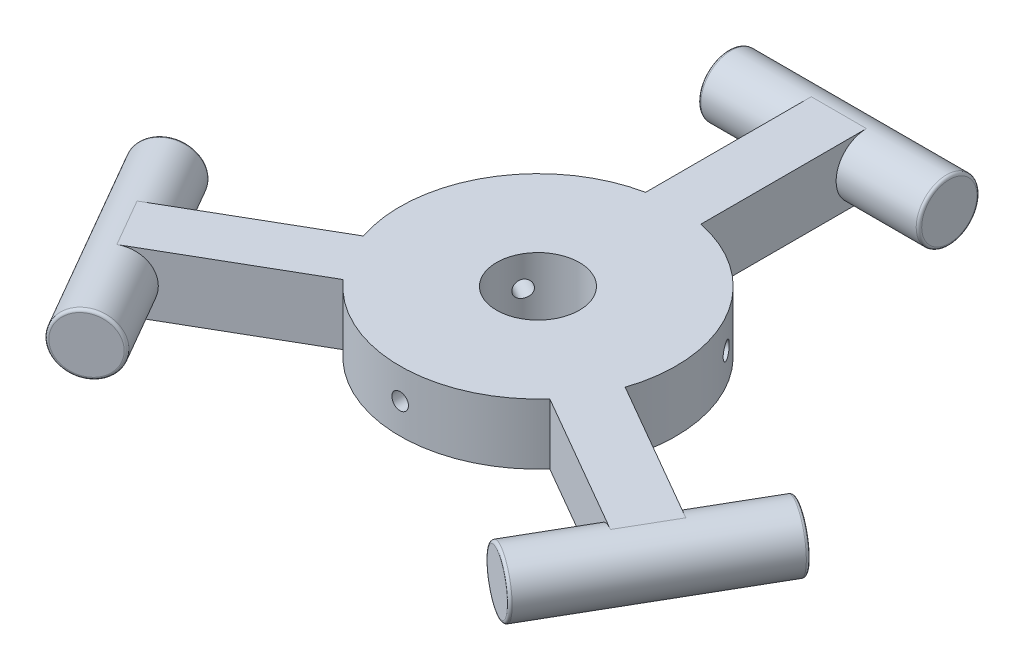
from build123d import *

# Parameters (mm, degrees)
BOSS_EXTRUDE1_DEPTH = 11
CIRPATTERN1_COUNT   = 3
SKETCH4_R           = 1.5
CUT_EXTRUDE1_DEPTH  = 20
CIRPATTERN3_COUNT   = 3


with BuildPart() as part:
    # Sketch1 → Boss-Extrude1 (new body)
    with BuildSketch(Plane(origin=(0, 0, 0), x_dir=(1, 0, 0), z_dir=(0, 1, 0))):
        with BuildLine():
            ThreePointArc((5, 24.494897428), (2.51272405, 24.873403825), (0, 25))
            Line((0, 25), (0, 7.5))
            ThreePointArc((0, 7.5), (5.303300859, 5.303300859), (7.5, 0))
            ThreePointArc((7.5, 0), (5.303300859, -5.303300859), (0, -7.5))
            Line((0, -7.5), (0, -25))
            ThreePointArc((0, -25), (10.260619052, -22.797361616), (18.713203436, -16.577575733))
            ThreePointArc((18.713203436, -16.577575733), (21.650635095, -12.5), (23.713203436, -7.917321695))
            ThreePointArc((23.713203436, -7.917321695), (24.676203982, -4.010605572), (25, 0))
            ThreePointArc((25, 0), (19.364916731, 15.811388301), (5, 24.494897428))
        make_face()
        with BuildLine():
            Line((0, 7.5), (0, 25))
            ThreePointArc((0, 25), (-2.51272405, 24.873403825), (-5, 24.494897428))
            ThreePointArc((-5, 24.494897428), (-21.650635095, 12.5), (-23.713203436, -7.917321695))
            ThreePointArc((-23.713203436, -7.917321695), (-21.650635095, -12.5), (-18.713203436, -16.577575733))
            ThreePointArc((-18.713203436, -16.577575733), (-10.260619052, -22.797361616), (0, -25))
            Line((0, -25), (0, -7.5))
            ThreePointArc((0, -7.5), (-7.5, 0), (0, 7.5))
        make_face()
        with BuildLine():
            Line((5, 54.494897428), (0, 54.494897428))
            Line((0, 54.494897428), (0, 25))
            ThreePointArc((0, 25), (2.51272405, 24.873403825), (5, 24.494897428))
            Line((5, 24.494897428), (5, 54.494897428))
        make_face()
        with BuildLine():
            Line((0, 25), (0, 54.494897428))
            Line((0, 54.494897428), (-5, 54.494897428))
            Line((-5, 54.494897428), (-5, 24.494897428))
            ThreePointArc((-5, 24.494897428), (-2.51272405, 24.873403825), (0, 25))
        make_face()
        with BuildLine():
            Line((49.693965549, -22.917321695), (23.713203436, -7.917321695))
            ThreePointArc((23.713203436, -7.917321695), (21.650635095, -12.5), (18.713203436, -16.577575733))
            Line((18.713203436, -16.577575733), (44.693965549, -31.577575733))
            Line((44.693965549, -31.577575733), (49.693965549, -22.917321695))
        make_face()
        with BuildLine():
            ThreePointArc((-18.713203436, -16.577575733), (-21.650635095, -12.5), (-23.713203436, -7.917321695))
            Line((-23.713203436, -7.917321695), (-49.693965549, -22.917321695))
            Line((-49.693965549, -22.917321695), (-44.693965549, -31.577575733))
            Line((-44.693965549, -31.577575733), (-18.713203436, -16.577575733))
        make_face()
    extrude(amount=BOSS_EXTRUDE1_DEPTH)

    # Sketch2 → Revolve1 (revolve)
    with BuildSketch(Plane(origin=(47.193965549, 0, 27.247448714), x_dir=(0.5000000000000038, 0, -0.8660254037844366), z_dir=(0.8660254037844365, 0, 0.5000000000000037)), mode=Mode.PRIVATE) as revolve1_sk:
        with BuildLine():
            Line((-19.5, 0), (19.5, 0))
            ThreePointArc((19.5, 0), (19.853553391, 0.146446609), (20, 0.5))
            Line((20, 0.5), (20, 5.5))
            Line((20, 5.5), (-20, 5.5))
            Line((-20, 5.5), (-20, 0.5))
            ThreePointArc((-20, 0.5), (-19.853553391, 0.146446609), (-19.5, 0))
        make_face()
    revolve1 = revolve(revolve1_sk.sketch.rotate(Axis((57.193965549, 5.5, 9.926940638), (-0.5000000000000036, 0, 0.8660254037844366)), 270), axis=Axis((57.193965549, 5.5, 9.926940638), (-0.5000000000000036, 0, 0.8660254037844366)))

    # CirPattern1: Revolve1 ×3 about axis
    cirpattern1_axis = Axis((0, 0, 0), (0, 1, 0))
    for i in range(1, CIRPATTERN1_COUNT):
        add(revolve1.rotate(cirpattern1_axis, i * 360 / CIRPATTERN1_COUNT))

    # Sketch4 → Cut-Extrude1 (cut)
    with BuildSketch(Plane.XY.offset(25)):
        with Locations((0, 5.5)):
            Circle(SKETCH4_R)
    cut_extrude1 = extrude(amount=-CUT_EXTRUDE1_DEPTH, mode=Mode.SUBTRACT)

    # CirPattern3: Cut-Extrude1 ×3 about axis
    cirpattern3_axis = Axis((0, 11, 0), (0, 1, 0))
    for i in range(1, CIRPATTERN3_COUNT):
        add(cut_extrude1.rotate(cirpattern3_axis, i * 360 / CIRPATTERN3_COUNT), mode=Mode.SUBTRACT)


solid = part.part
